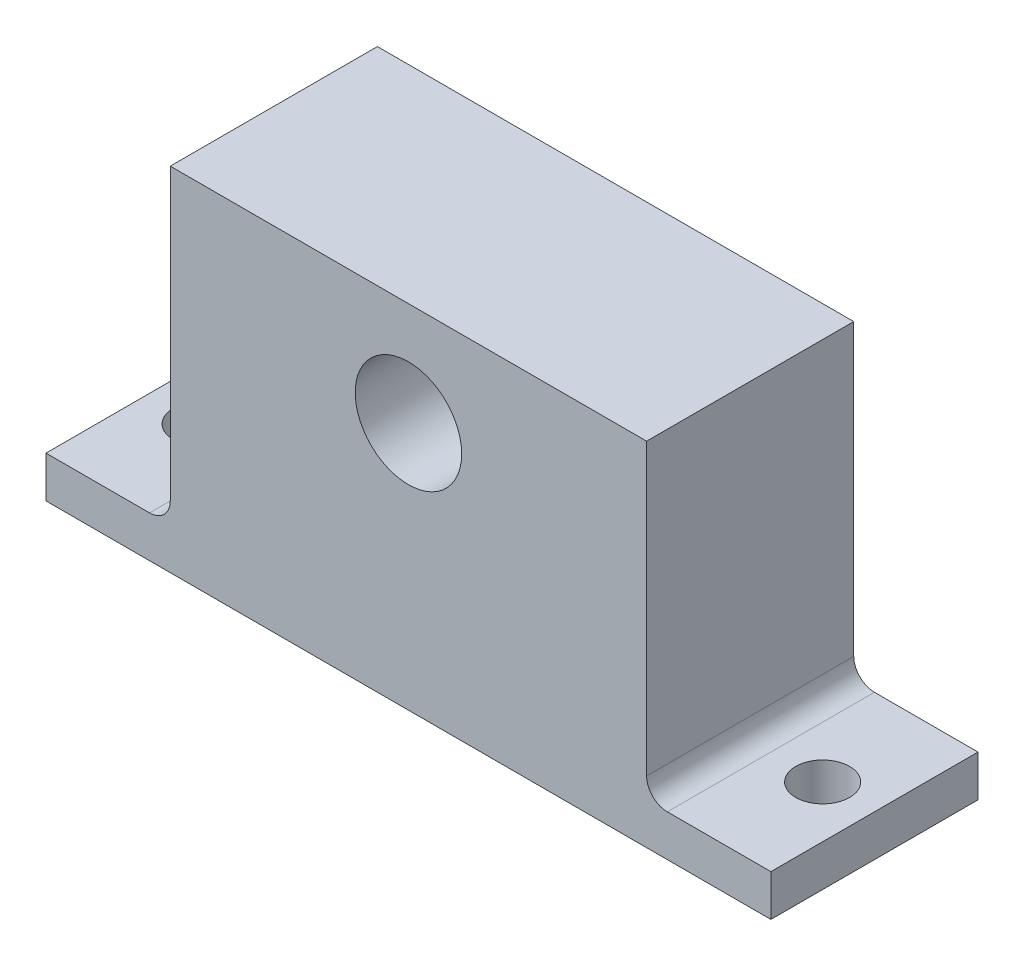
from build123d import *

# Parameters (mm, degrees)
SKETCH1_W           = 44.45
SKETCH1_H           = 21.59
BOSS_EXTRUDE1_DEPTH = 12.7
SKETCH2_W           = 7.62
SKETCH2_H           = 19.05
CUT_EXTRUDE1_DEPTH  = 12.7
FILLET1_R           = 1.27
FILLET2_R           = 1.27
SKETCH4_R           = 1.651
CUT_EXTRUDE3_DEPTH  = 12.7
SKETCH5_R           = 1.8034
CUT_EXTRUDE4_DEPTH  = 12.7
SKETCH6_R           = 3.2639
CUT_EXTRUDE5_DEPTH  = 5.08


with BuildPart() as part:
    # Sketch1 → Boss-Extrude1 (new body)
    with BuildSketch(Plane.XY):
        Rectangle(SKETCH1_W, SKETCH1_H)
    extrude(amount=BOSS_EXTRUDE1_DEPTH)

    # Sketch2 → Cut-Extrude1 (cut)
    with BuildSketch(Plane.XY.offset(12.7)):
        with Locations((-18.415, 1.27)):
            Rectangle(SKETCH2_W, SKETCH2_H)
        with Locations((18.415, 1.27)):
            Rectangle(SKETCH2_W, SKETCH2_H)
    extrude(amount=-CUT_EXTRUDE1_DEPTH, mode=Mode.SUBTRACT)

    # Fillet1
    fillet1_edges = [part.edges().sort_by_distance(p)[0] for p in [
        (-14.605, -8.255, 6.35),
    ]]
    fillet(fillet1_edges, radius=FILLET1_R)

    # Fillet2
    fillet2_edges = [part.edges().sort_by_distance(p)[0] for p in [
        (14.605, -8.255, 6.35),
    ]]
    fillet(fillet2_edges, radius=FILLET2_R)

    # Sketch4 → Cut-Extrude3 (cut)
    with BuildSketch(Plane(origin=(0, -8.255, 0), x_dir=(1, 0, 0), z_dir=(0, 1, 0))):
        with Locations(Location((19.05, -6.35, 0), (0, 0, 180))):
            Circle(SKETCH4_R)
        with Locations(Location((-19.05, -6.4262, 0), (0, 0, 180))):
            Circle(SKETCH4_R)
    extrude(amount=-CUT_EXTRUDE3_DEPTH, mode=Mode.SUBTRACT)

    # Sketch5 → Cut-Extrude4 (cut)
    with BuildSketch(Plane(origin=(0, 0, 0), x_dir=(-1, 0, 0), z_dir=(0, 0, -1))):
        with Locations((0, 4.445)):
            Circle(SKETCH5_R)
    extrude(amount=-CUT_EXTRUDE4_DEPTH, mode=Mode.SUBTRACT)

    # Sketch6 → Cut-Extrude5 (cut)
    with BuildSketch(Plane.XY.offset(12.7)):
        with Locations((0, 4.445)):
            Circle(SKETCH6_R)
    extrude(amount=-CUT_EXTRUDE5_DEPTH, mode=Mode.SUBTRACT)


solid = part.part
